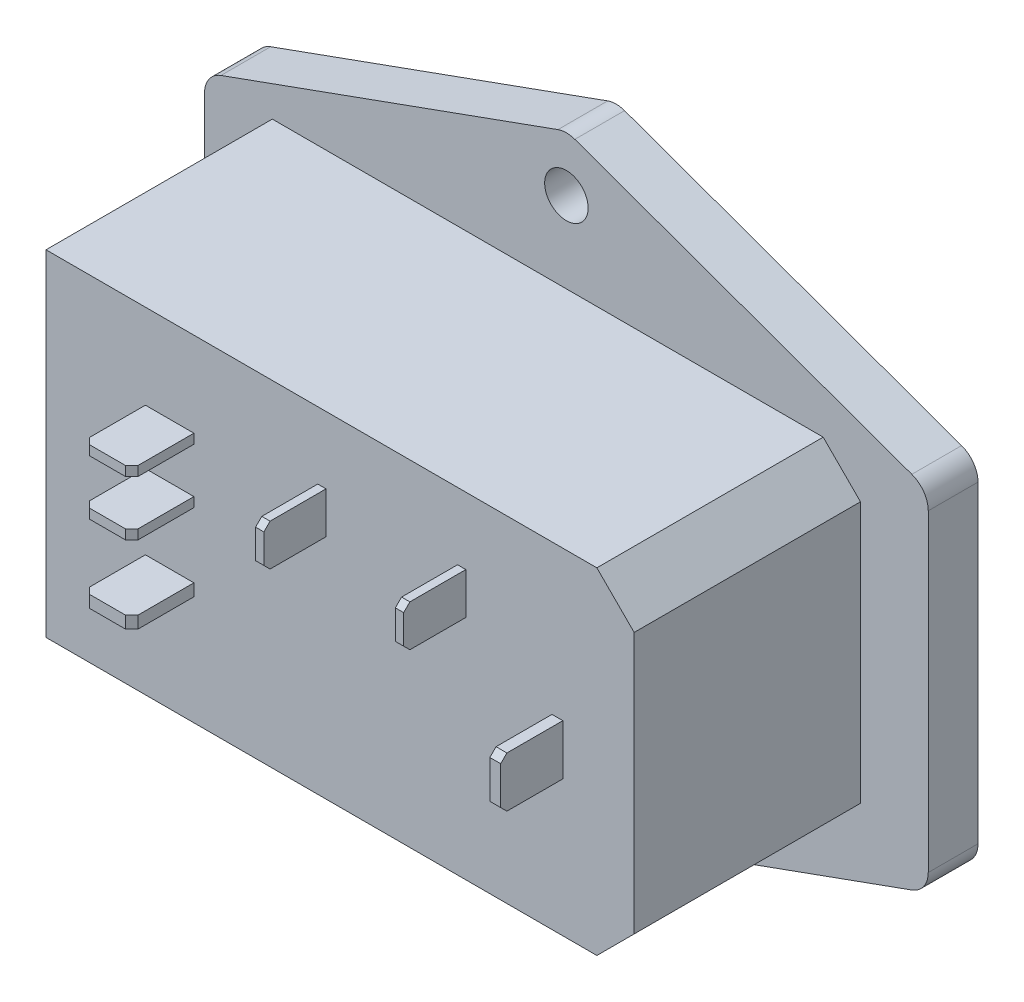
from build123d import *

# Parameters (mm, degrees)
SALIENTE_EXTRUIR1_DEPTH             = 4
SALIENTE_EXTRUIR2_DEPTH             = 6
CROQUIS3_W                          = 47.3
CROQUIS3_H                          = 27
SALIENTE_EXTRUIR3_DEPTH             = 18.2
CROQUIS4_W                          = 0.667325014
CROQUIS4_H                          = 3.336625071
SALIENTE_EXTRUIR4_DEPTH             = 5
CROQUIS5_W                          = 3.901284698
CROQUIS5_H                          = 0.975321174
SALIENTE_EXTRUIR5_DEPTH             = 5
CROQUIS6_W                          = 3.901284698
CROQUIS6_H                          = 0.769990401
SALIENTE_EXTRUIR6_DEPTH             = 5
CROQUIS7_W                          = 3.901284698
CROQUIS7_H                          = 0.769990401
SALIENTE_EXTRUIR7_DEPTH             = 5
CROQUIS8_W                          = 0.667325014
CROQUIS8_H                          = 3.336625071
SALIENTE_EXTRUIR8_DEPTH             = 5
CROQUIS9_W                          = 0.872655788
CROQUIS9_H                          = 4.055282778
SALIENTE_EXTRUIR9_DEPTH             = 5
CROQUIS10_W                         = 16.5
CROQUIS10_H                         = 24.3
CORTAR_EXTRUIR1_DEPTH               = 10
CROQUIS11_W                         = 2.829874194
CROQUIS11_H                         = 0.613139408
SALIENTE_EXTRUIR10_DEPTH            = 8
CROQUIS12_W                         = 3.562339964
CROQUIS12_H                         = 0.743785267
SALIENTE_EXTRUIR11_DEPTH            = 8
CROQUIS13_W                         = 2.722244645
CROQUIS13_H                         = 0.822078453
SALIENTE_EXTRUIR12_DEPTH            = 8
NGULO_DE_SALIDA1_ANGLE              = 18.434948823
DI_METRO_DE_TALADRO_3_5_3_5_1_D     = 3.5
DI_METRO_DE_TALADRO_3_5_3_5_1_DEPTH = 27.2
CHAFL_N1_SIZE                       = 0.5
CHAFL_N2_SIZE                       = 4.37601031
CHAFL_N2_SIZE2                      = 3.39475551
CHAFL_N3_SIZE                       = 1.5
CHAFL_N4_SIZE                       = 3
CHAFL_N5_SIZE                       = 3.39475551
CHAFL_N5_SIZE2                      = 4.37601031
REDONDEO1_R                         = 2


with BuildPart() as part:
    # Croquis1 → Saliente-Extruir1 (new body)
    with BuildSketch(Plane.XY):
        Polygon((29.1, -14), (29.1, 14), (0, 24.5), (-29.1, 14), (-29.1, -14), (0, -24.5), align=None)
    extrude(amount=-SALIENTE_EXTRUIR1_DEPTH)

    # Croquis2 → Saliente-Extruir2 (add)
    with BuildSketch(Plane(origin=(-16.65, 0, 0), x_dir=(0, -1, 0), z_dir=(-1, 0, 0))):
        with BuildLine():
            Line((-7.937538523, -4.623203122), (9.312425582, -9.446383875))
            ThreePointArc((9.312425582, -9.446383875), (9.487171309, -9.41309977), (9.56628106, -9.253771343))
            Line((9.56628106, -9.253771343), (9.56628106, -4))
            Line((9.56628106, -4), (-7.937538523, -4))
            Line((-7.937538523, -4), (-7.937538523, -4.623203122))
        make_face()
    extrude(amount=-SALIENTE_EXTRUIR2_DEPTH)

    # Croquis3 → Saliente-Extruir3 (add)
    with BuildSketch(Plane.XY):
        Rectangle(CROQUIS3_W, CROQUIS3_H)
    extrude(amount=SALIENTE_EXTRUIR3_DEPTH)

    # Croquis4 → Saliente-Extruir4 (add)
    with BuildSketch(Plane.XY.offset(18.2)):
        with Locations((9.778878091, 6.442253021)):
            Rectangle(CROQUIS4_W, CROQUIS4_H)
    extrude(amount=SALIENTE_EXTRUIR4_DEPTH)

    # Croquis5 → Saliente-Extruir5 (add)
    with BuildSketch(Plane.XY.offset(18.2)):
        with Locations((-13.705829136, -4.234947205)):
            Rectangle(CROQUIS5_W, CROQUIS5_H)
    extrude(amount=SALIENTE_EXTRUIR5_DEPTH)

    # Croquis6 → Saliente-Extruir6 (add)
    with BuildSketch(Plane.XY.offset(18.2)):
        with Locations((-13.705829136, 6.28825494)):
            Rectangle(CROQUIS6_W, CROQUIS6_H)
    extrude(amount=SALIENTE_EXTRUIR6_DEPTH)

    # Croquis7 → Saliente-Extruir7 (add)
    with BuildSketch(Plane.XY.offset(18.2)):
        with Locations((-13.705829136, 1.873643309)):
            Rectangle(CROQUIS7_W, CROQUIS7_H)
    extrude(amount=SALIENTE_EXTRUIR7_DEPTH)

    # Croquis8 → Saliente-Extruir8 (add)
    with BuildSketch(Plane.XY.offset(18.2)):
        with Locations((-1.462981762, 6.442253021)):
            Rectangle(CROQUIS8_W, CROQUIS8_H)
    extrude(amount=SALIENTE_EXTRUIR8_DEPTH)

    # Croquis9 → Saliente-Extruir9 (add)
    with BuildSketch(Plane.XY.offset(18.2)):
        with Locations((17.4787821, -0.538993281)):
            Rectangle(CROQUIS9_W, CROQUIS9_H)
    extrude(amount=SALIENTE_EXTRUIR9_DEPTH)

    # Croquis10 → Cortar-Extruir1 (cut)
    with BuildSketch(Plane(origin=(0, 0, -4), x_dir=(-1, 0, 0), z_dir=(0, 0, -1))):
        with Locations((-15.126658105, 0)):
            Rectangle(CROQUIS10_W, CROQUIS10_H)
    extrude(amount=-CORTAR_EXTRUIR1_DEPTH, mode=Mode.SUBTRACT)

    # Croquis11 → Saliente-Extruir10 (add)
    with BuildSketch(Plane(origin=(0, 0, 6), x_dir=(-1, 0, 0), z_dir=(0, 0, -1))):
        with Locations((-13.664176667, 4.590692106)):
            Rectangle(CROQUIS11_W, CROQUIS11_H)
    extrude(amount=SALIENTE_EXTRUIR10_DEPTH)

    # Croquis12 → Saliente-Extruir11 (add)
    with BuildSketch(Plane(origin=(0, 0, 6), x_dir=(-1, 0, 0), z_dir=(0, 0, -1))):
        with Locations((-14.008336533, -5.017674074)):
            Rectangle(CROQUIS12_W, CROQUIS12_H)
    extrude(amount=SALIENTE_EXTRUIR11_DEPTH)

    # Croquis13 → Saliente-Extruir12 (add)
    with BuildSketch(Plane(origin=(0, 0, 6), x_dir=(-1, 0, 0), z_dir=(0, 0, -1))):
        with Locations((-18.481613001, 0.423702356)):
            Rectangle(CROQUIS13_W, CROQUIS13_H)
    extrude(amount=SALIENTE_EXTRUIR12_DEPTH)

    # Ángulo de salida1
    ngulo_de_salida1_faces = [part.faces().sort_by_distance(p)[0] for p in [
        (-13.65, 7.937538523, -4.311601561),
    ]]
    draft(ngulo_de_salida1_faces, Plane(origin=(0, 0, -4), x_dir=(-1, 0, 0), z_dir=(0, 0, -1)), NGULO_DE_SALIDA1_ANGLE)

    # Diámetro de taladro Ø3.5 (3.5)1
    with Locations(Plane(origin=(0, 0, -4), x_dir=(-1, 0, 0), z_dir=(0, 0, -1))):
        with Locations((0, -20), (0, 20)):
            Hole(DI_METRO_DE_TALADRO_3_5_3_5_1_D / 2, depth=DI_METRO_DE_TALADRO_3_5_3_5_1_DEPTH)

    # Chaflán1
    chafl_n1_edges = [part.edges().sort_by_distance(p)[0] for p in [
        (17.120490678, 0.423702356, -2),
        (-11.755186787, 6.288254941, 23.2),
        (-15.656471485, 1.873643309, 23.2),
        (-1.462981762, 8.110565556, 23.2),
        (-1.462981762, 4.773940485, 23.2),
        (-11.755186787, 1.873643309, 23.2),
        (17.4787821, 1.488648108, 23.2),
        (17.4787821, -2.56663467, 23.2),
        (15.079113764, 4.590692106, -2),
        (9.778878091, 4.773940485, 23.2),
        (-15.656471485, -4.234947205, 23.2),
        (-11.755186787, -4.234947205, 23.2),
        (-15.656471485, 6.288254941, 23.2),
        (12.227166551, -5.017674073, -2),
        (19.842735323, 0.423702356, -2),
        (12.24923957, 4.590692106, -2),
        (9.778878091, 8.110565556, 23.2),
        (15.789506515, -5.017674073, -2),
    ]]
    chamfer(chafl_n1_edges, length=CHAFL_N1_SIZE)

    # Chaflán2
    chafl_n2_edges = [part.edges().sort_by_distance(p)[0] for p in [
        (23.376658105, -12.15, 1),
    ]]
    chafl_n2_side = [part.faces().sort_by_distance(p)[0] for p in [
        (15.126658105, -12.15, 1),
    ]]
    chamfer(chafl_n2_edges, length=CHAFL_N2_SIZE, length2=CHAFL_N2_SIZE2, reference=chafl_n2_side[0])

    # Chaflán3
    chafl_n3_edges = [part.edges().sort_by_distance(p)[0] for p in [
        (-1.75, 20, -4),
        (-1.75, -20, -4),
    ]]
    chamfer(chafl_n3_edges, length=CHAFL_N3_SIZE)

    # Chaflán4
    chafl_n4_edges = [part.edges().sort_by_distance(p)[0] for p in [
        (23.65, -13.5, 9.1),
        (23.65, 13.5, 9.1),
    ]]
    chamfer(chafl_n4_edges, length=CHAFL_N4_SIZE)

    # Chaflán5
    chafl_n5_edges = [part.edges().sort_by_distance(p)[0] for p in [
        (23.376658105, 12.15, 1),
    ]]
    chafl_n5_side = [part.faces().sort_by_distance(p)[0] for p in [
        (23.376658105, 1.697377755, 1),
    ]]
    chamfer(chafl_n5_edges, length=CHAFL_N5_SIZE, length2=CHAFL_N5_SIZE2, reference=chafl_n5_side[0])

    # Redondeo1
    redondeo1_edges = [part.edges().sort_by_distance(p)[0] for p in [
        (0, -24.5, -2),
        (-29.1, -14, -2),
        (-29.1, 14, -2),
        (0, 24.5, -2),
        (29.1, 14, -2),
        (29.1, -14, -2),
    ]]
    fillet(redondeo1_edges, radius=REDONDEO1_R)


solid = part.part
